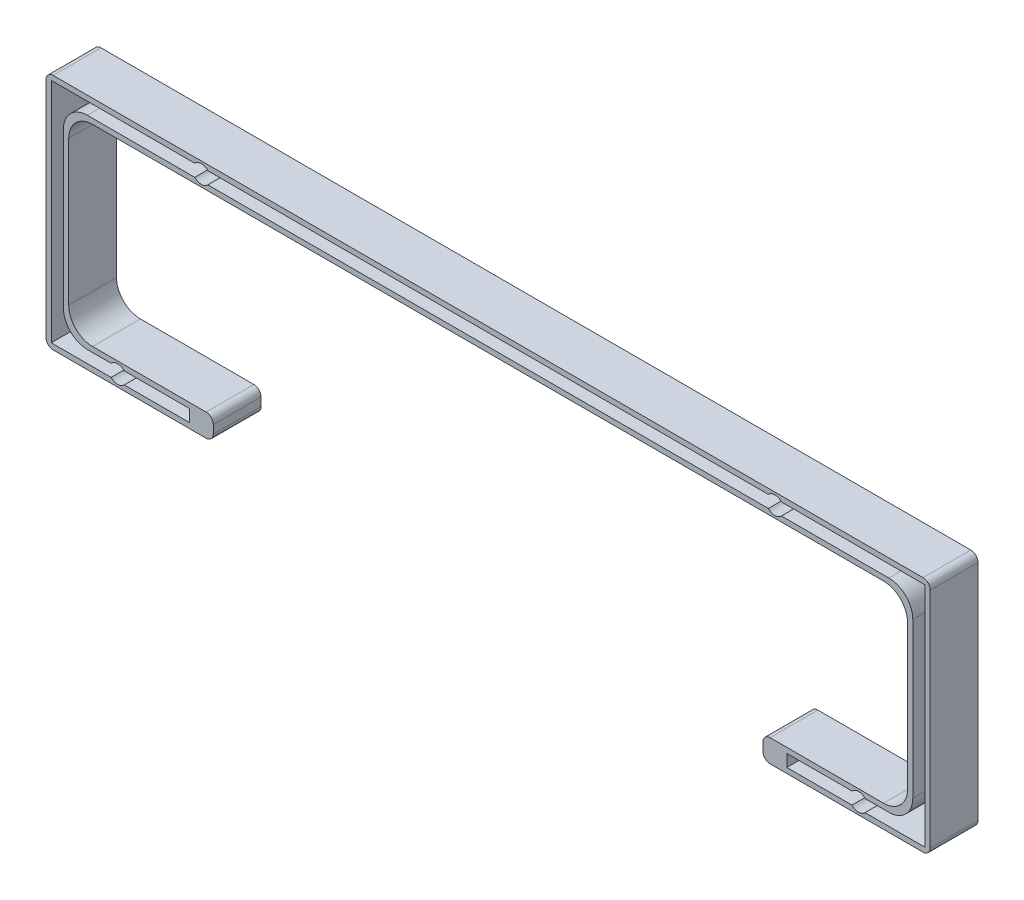
from build123d import *

# Parameters (mm, degrees)
BOSS_EXTRUDE1_DEPTH     = 20
CUT_EXTRUDE_THIN1_DEPTH = 17
FILLET1_R               = 10
SKETCH3_R               = 3.75
SKETCH3_R_2             = 2.25
CUT_EXTRUDE1_DEPTH      = 17
SKETCH3_2_R             = 2.25
CUT_EXTRUDE2_DEPTH      = 207.700266086
FILLET2_R               = 3
SKETCH4_W               = 5
SKETCH4_H               = 5.1
CUT_EXTRUDE3_DEPTH      = 207.43158673


with BuildPart() as part:
    # Sketch1 → Boss-Extrude1 (new body)
    with BuildSketch(Plane.XY):
        Polygon((-115, 0), (-175.5, 0), (-175.5, 80.5), (175.5, 80.5), (175.5, 0), (115, 0), (115, -9.5), (185, -9.5), (185, 90), (-185, 90), (-185, -9.5), (-115, -9.5), align=None)
    extrude(amount=BOSS_EXTRUDE1_DEPTH)

    # Sketch2 → Cut-Extrude-Thin1 (cut)
    with BuildSketch(Plane.XY.offset(20)):
        Polygon((-125, -2.2), (-177.7, -2.2), (-177.7, 82.7), (177.7, 82.7), (177.7, -2.2), (125, -2.2), (125, -7.3), (182.8, -7.3), (182.8, 87.8), (-182.8, 87.8), (-182.8, -7.3), (-125, -7.3), align=None)
    extrude(amount=-CUT_EXTRUDE_THIN1_DEPTH, mode=Mode.SUBTRACT)

    # Fillet1
    fillet1_edges = [part.edges().sort_by_distance(p)[0] for p in [
        (175.5, 0, 10),
        (175.5, 80.5, 10),
        (-175.5, 80.5, 10),
        (-175.5, 0, 10),
        (-177.7, -2.2, 11.5),
        (-177.7, 82.7, 11.5),
        (177.7, 82.7, 11.5),
        (177.7, -2.2, 11.5),
    ]]
    fillet(fillet1_edges, radius=FILLET1_R)

    # Sketch3 → Cut-Extrude1 (cut)
    # profile 1 of 4: a face of its own
    with BuildSketch(Plane.XY.offset(20)):
        with Locations((-120, 85.25)):
            Circle(SKETCH3_R)
        with Locations((-120, 85.25)):
            Circle(SKETCH3_R_2, mode=Mode.SUBTRACT)
    # profile 2 of 4: a face of its own
    with BuildSketch(Plane.XY.offset(20)):
        with Locations((120, 85.25)):
            Circle(SKETCH3_R)
        with Locations((120, 85.25)):
            Circle(SKETCH3_R_2, mode=Mode.SUBTRACT)
    # profile 3 of 4: a face of its own
    with BuildSketch(Plane.XY.offset(20)):
        with Locations((-155, -4.75)):
            Circle(SKETCH3_R)
        with Locations((-155, -4.75)):
            Circle(SKETCH3_R_2, mode=Mode.SUBTRACT)
    # profile 4 of 4: a face of its own
    with BuildSketch(Plane.XY.offset(20)):
        with Locations((155, -4.75)):
            Circle(SKETCH3_R)
        with Locations((155, -4.75)):
            Circle(SKETCH3_R_2, mode=Mode.SUBTRACT)
    extrude(amount=-CUT_EXTRUDE1_DEPTH, mode=Mode.SUBTRACT)

    # Sketch3<2> → Cut-Extrude2 (cut, through all)
    with BuildSketch(Plane.XY.offset(20)):
        with Locations((-120, 85.25)):
            Circle(SKETCH3_2_R)
        with Locations((-155, -4.75)):
            Circle(SKETCH3_2_R)
        with Locations((155, -4.75)):
            Circle(SKETCH3_2_R)
        with Locations((120, 85.25)):
            Circle(SKETCH3_2_R)
    extrude(amount=-CUT_EXTRUDE2_DEPTH, mode=Mode.SUBTRACT)

    # Fillet2
    fillet2_edges = [part.edges().sort_by_distance(p)[0] for p in [
        (-115, -9.5, 10),
        (-185, -9.5, 10),
        (-185, 90, 10),
        (185, 90, 10),
        (185, -9.5, 10),
        (115, -9.5, 10),
        (115, 0, 10),
        (-115, 0, 10),
    ]]
    fillet(fillet2_edges, radius=FILLET2_R)

    # Sketch4 → Cut-Extrude3 (cut, through all)
    with BuildSketch(Plane.XY.offset(3)):
        with Locations((-127.5, -4.75)):
            Rectangle(SKETCH4_W, SKETCH4_H)
        with Locations((127.5, -4.75)):
            Rectangle(SKETCH4_W, SKETCH4_H)
    extrude(amount=-CUT_EXTRUDE3_DEPTH, mode=Mode.SUBTRACT)


solid = part.part
